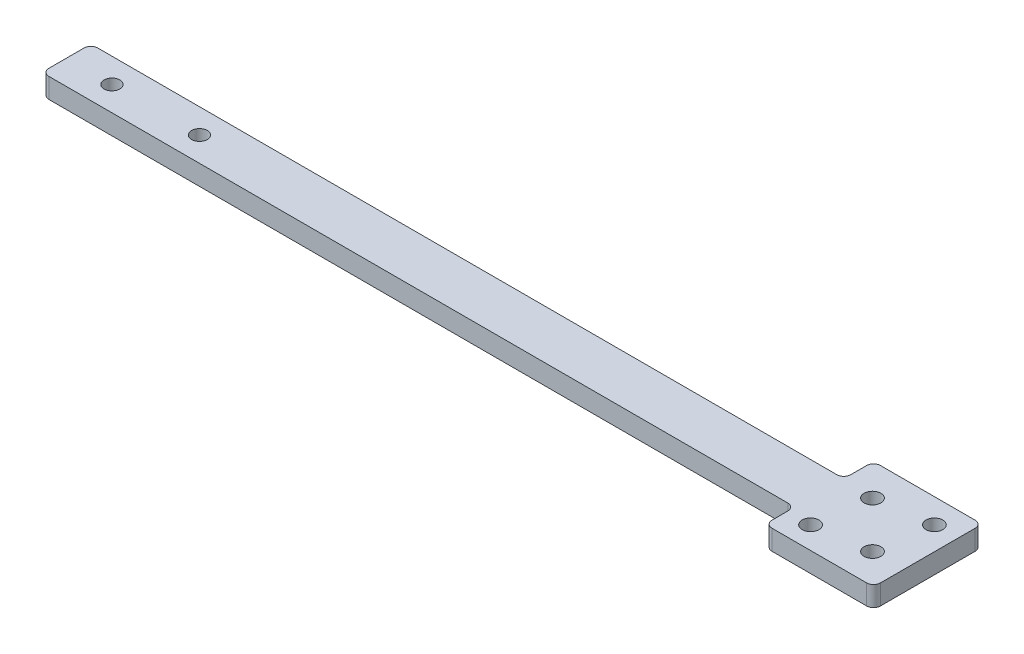
from build123d import *

# Parameters (mm, degrees)
SKETCH1_W           = 215
SKETCH1_H           = 14
BOSS_EXTRUDE1_DEPTH = 5.715
SKETCH2_R           = 2.25
CUT_EXTRUDE1_DEPTH  = 165.711508072
SKETCH3_W           = 31
SKETCH3_H           = 5.715
BOSS_EXTRUDE2_DEPTH = 31
SKETCH4_R           = 2.4
CUT_EXTRUDE2_DEPTH  = 166.307011988
FILLET1_R           = 2


with BuildPart() as part:
    # Sketch1 → Boss-Extrude1 (new body)
    with BuildSketch(Plane(origin=(0, 0, 0), x_dir=(1, 0, 0), z_dir=(0, 1, 0))):
        with Locations((-56.94992329, 0.310430648)):
            Rectangle(SKETCH1_W, SKETCH1_H)
    extrude(amount=BOSS_EXTRUDE1_DEPTH)

    # Sketch2 → Cut-Extrude1 (cut, through all)
    with BuildSketch(Plane(origin=(0, 5.715, 0), x_dir=(1, 0, 0), z_dir=(0, 1, 0))):
        with Locations(Location((-151.44992329, 0.310430648, 0), (0, 0, 270))):
            Circle(SKETCH2_R)
        with Locations(Location((-126.44992329, 0.310430648, 0), (0, 0, 270))):
            Circle(SKETCH2_R)
    extrude(amount=-CUT_EXTRUDE1_DEPTH, mode=Mode.SUBTRACT)

    # Sketch3 → Boss-Extrude2 (add)
    with BuildSketch(Plane(origin=(50.55007671, 0, 0), x_dir=(0, 0, -1), z_dir=(1, 0, 0))):
        with Locations((0.310430648, 2.8575)):
            Rectangle(SKETCH3_W, SKETCH3_H)
    extrude(amount=BOSS_EXTRUDE2_DEPTH)

    # Sketch4 → Cut-Extrude2 (cut, through all)
    with BuildSketch(Plane(origin=(0, 5.715, 0), x_dir=(1, 0, 0), z_dir=(0, 1, 0))):
        with Locations(Location((57.211241945, -8.838834765, 0), (0, 0, 270))):
            Circle(SKETCH4_R)
        with Locations(Location((59.438628306, 6.611448404, 0), (0, 0, 270))):
            Circle(SKETCH4_R)
        with Locations(Location((74.888911475, 8.838834765, 0), (0, 0, 270))):
            Circle(SKETCH4_R)
        with Locations(Location((72.661525114, -6.611448404, 0), (0, 0, 270))):
            Circle(SKETCH4_R)
    extrude(amount=-CUT_EXTRUDE2_DEPTH, mode=Mode.SUBTRACT)

    # Fillet1
    fillet1_edges = [part.edges().sort_by_distance(p)[0] for p in [
        (-164.44992329, 2.8575, -7.310430648),
        (-164.44992329, 2.8575, 6.689569352),
        (50.55007671, 2.8575, -7.310430648),
        (50.55007671, 2.8575, 6.689569352),
        (50.55007671, 2.8575, -15.810430648),
        (81.55007671, 2.8575, -15.810430648),
        (81.55007671, 2.8575, 15.189569352),
        (50.55007671, 2.8575, 15.189569352),
    ]]
    fillet(fillet1_edges, radius=FILLET1_R)


solid = part.part
